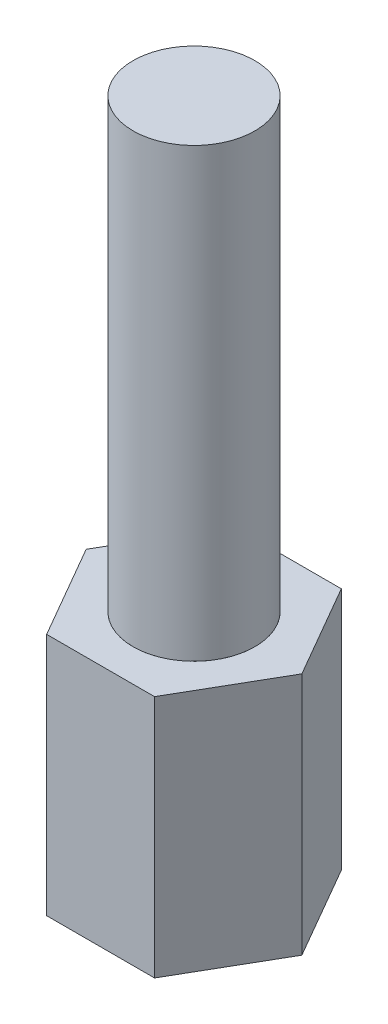
from build123d import *

# Parameters (mm, degrees)
EXTRUDE_1_DEPTH     = 6
SKETCH_3_R          = 1.5
EXTRUDE_2_DEPTH     = 11
SKETCH_4_R          = 1.5
CUT_EXTRUDE_1_DEPTH = 6


with BuildPart() as part:
    # 草图1 → 凸台-拉伸1 (new body)
    with BuildSketch(Plane(origin=(0, 0, 0), x_dir=(1, 0, 0), z_dir=(0, 1, 0))):
        Polygon((-1.327905619, 2.3), (-2.655811238, 0), (-1.327905619, -2.3), (1.327905619, -2.3), (2.655811238, 0), (1.327905619, 2.3), align=None)
    extrude(amount=EXTRUDE_1_DEPTH)

    # 草图3 → 凸台-拉伸2 (add)
    with BuildSketch(Plane(origin=(0, 6, 0), x_dir=(1, 0, 0), z_dir=(0, 1, 0))):
        with Locations(Location((0, 0, 0), (0, 0, 270))):
            Circle(SKETCH_3_R)
    extrude(amount=EXTRUDE_2_DEPTH)

    # 草图4 → 切除-拉伸1 (cut)
    with BuildSketch(Plane.XZ):
        with Locations(Location((0, 0, 0), (0, 0, 270))):
            Circle(SKETCH_4_R)
    extrude(amount=-CUT_EXTRUDE_1_DEPTH, mode=Mode.SUBTRACT)


with BuildPart() as cut_extrude_1_piece_1:
    # of the separate pieces the step leaves, piece 1, a body of its own (cut_extrude_1_pieces)
    add(part.part.solids().sort_by_distance((0, 17, 1.5))[0])


with BuildPart() as cut_extrude_1_piece_2:
    # of the separate pieces the step leaves, piece 2, a body of its own (cut_extrude_1_pieces)
    add(part.part.solids().sort_by_distance((-1.327905619, 0, -2.3))[0])


solid = Compound([cut_extrude_1_piece_1.part, cut_extrude_1_piece_2.part])
